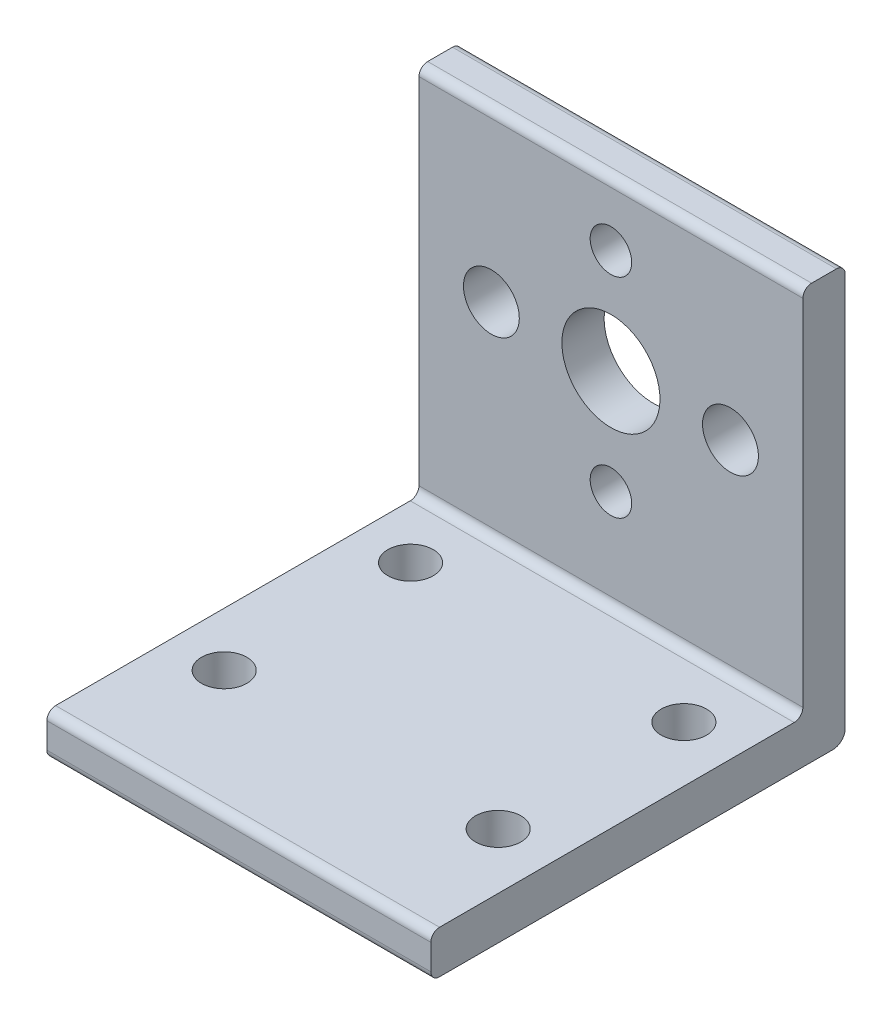
from build123d import *

# Parameters (mm, degrees)
BOSS_EXTRUDE1_DEPTH     = 27.94
SKETCH2_R               = 3.5687
SKETCH2_R_2             = 1.5113
SKETCH2_R_3             = 2.032
MOTOR_MOUNT_HOLES_DEPTH = 51.992124246
SKETCH3_R               = 1.651
PLATE_MOUNT_HOLES_DEPTH = 51.992124246
FILLET1_R               = 0.635
FILLET2_R               = 0.889
FILLET3_R               = 0.635


with BuildPart() as part:
    # Sketch1 → Boss-Extrude1 (new body)
    with BuildSketch(Plane(origin=(0, 0, 0), x_dir=(0, 0, -1), z_dir=(1, 0, 0))):
        Polygon((0, 0), (0, -30.1752), (-30.1498, -30.1752), (-30.1498, -27.051), (-3.0734, -27.051), (-3.0734, 0), align=None)
    extrude(amount=BOSS_EXTRUDE1_DEPTH)

    # Sketch2 → Motor_Mount_holes (cut, through all)
    with BuildSketch(Plane.XY):
        with Locations(Location((13.97, -12.2047, 0), (0, 0, 90))):
            Circle(SKETCH2_R)
        with Locations(Location((13.97, -4.6101, 0), (0, 0, 90))):
            Circle(SKETCH2_R_2)
        with Locations(Location((5.2705, -12.2047, 0), (0, 0, 90))):
            Circle(SKETCH2_R_3)
        with Locations(Location((22.6695, -12.2047, 0), (0, 0, 180))):
            Circle(SKETCH2_R_3)
        with Locations(Location((13.97, -19.7993, 0), (0, 0, 180))):
            Circle(SKETCH2_R_2)
    extrude(amount=MOTOR_MOUNT_HOLES_DEPTH, mode=Mode.SUBTRACT)

    # Sketch3 → Plate_Mount_Holes (cut, through all)
    with BuildSketch(Plane(origin=(0, -30.1752, 0), x_dir=(1, 0, 0), z_dir=(0, 1, 0))):
        with Locations(Location((3.9116, -7.5946, 0), (0, 0, 90))):
            Circle(SKETCH3_R)
        with Locations(Location((23.9014, -7.6962, 0), (0, 0, 90))):
            Circle(SKETCH3_R)
        with Locations(Location((3.9116, -21.1582, 0), (0, 0, 90))):
            Circle(SKETCH3_R)
        with Locations(Location((23.876, -21.1836, 0), (0, 0, 90))):
            Circle(SKETCH3_R)
    extrude(amount=PLATE_MOUNT_HOLES_DEPTH, mode=Mode.SUBTRACT)

    # Fillet1
    fillet1_edges = [part.edges().sort_by_distance(p)[0] for p in [
        (13.97, -27.051, 3.0734),
    ]]
    fillet(fillet1_edges, radius=FILLET1_R)

    # Fillet2
    fillet2_edges = [part.edges().sort_by_distance(p)[0] for p in [
        (13.97, -30.1752, 0),
    ]]
    fillet(fillet2_edges, radius=FILLET2_R)

    # Fillet3
    fillet3_edges = [part.edges().sort_by_distance(p)[0] for p in [
        (13.97, 0, 0),
        (13.97, -30.1752, 30.1498),
        (13.97, -27.051, 30.1498),
        (13.97, 0, 3.0734),
    ]]
    fillet(fillet3_edges, radius=FILLET3_R)


solid = part.part
